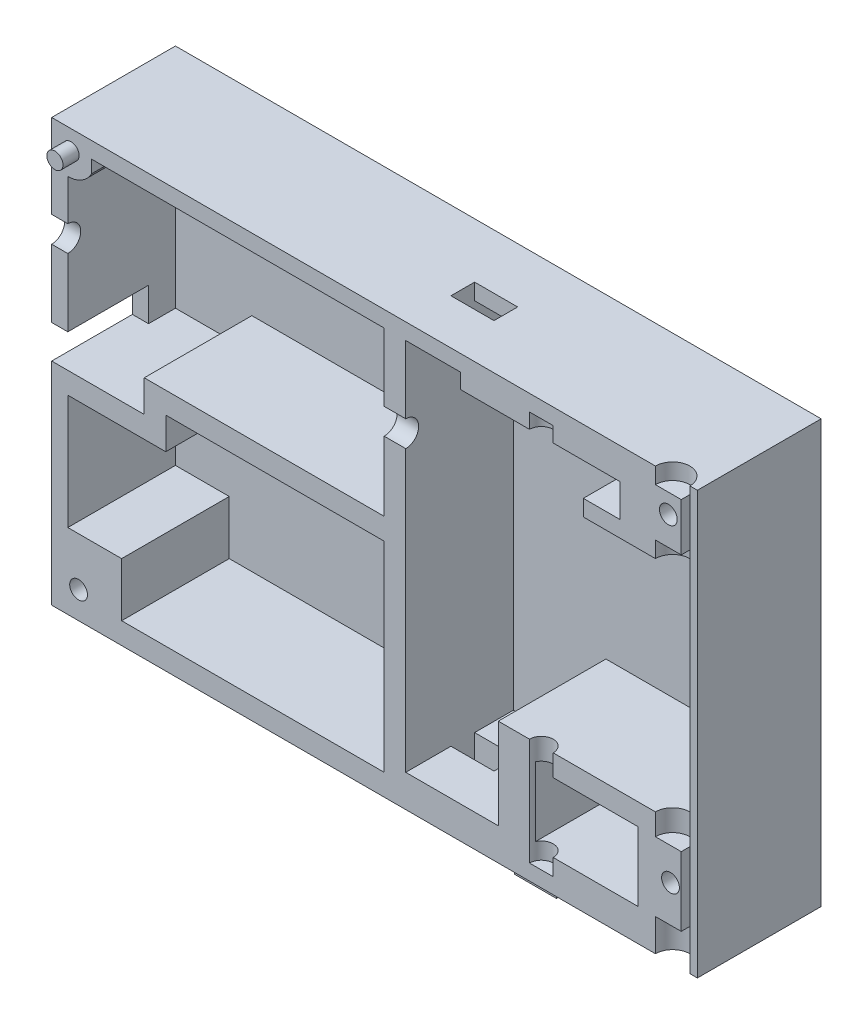
from build123d import *

# Parameters (mm, degrees)
SKETCH_1_W                      = 60
SKETCH_1_H                      = 52
EXTRUDE_1_DEPTH                 = 11.5
SHELL_1_T                       = -1.5
SKETCH_2_W                      = 15
SKETCH_2_H                      = 1.4
SKETCH_2_W_2                    = 9.1
SKETCH_2_H_2                    = 1.5
EXTRUDE_2_DEPTH                 = 10
CUT_EXTRUDE_1_REACH             = 63.125
SKETCH_3_W                      = 4
SKETCH_3_H                      = 2.2
SKETCH_4_R                      = 1.6
F_3MM_2_DEPTH                   = 62.124872188
F_2MM_4_START                   = -1.5
SKETCH_6_R                      = 1.1
F_2MM_4_DEPTH                   = 36.3
CUT_EXTRUDE_5_REACH             = 68.395
SKETCH_8_W                      = 7.5
SKETCH_8_H                      = 3.1
SKETCH_9_W                      = 5
SKETCH_9_H                      = 5
SKETCH_9_W_2                    = 5.7
SKETCH_9_H_2                    = 4.45
SKETCH_9_R                      = 0.825
SKETCH_9_W_3                    = 4
SKETCH_9_H_3                    = 6.42
EXTRUDE_4_DEPTH                 = 10
SKETCH_10_R                     = 0.75
EXTRUDE_5_DEPTH                 = 1.5
SKETCH_11_W                     = 3.9
SKETCH_11_H                     = 4
EXTRUDE_6_DEPTH                 = 4
CUT_EXTRUDE_1_2_REACH           = 43.331
SKETCH_13_R                     = 0.825
CUT_EXTRUDE_2_REACH             = 43.331
SKETCH_14_W                     = 60
SKETCH_14_H                     = 12.75
CUT_EXTRUDE_2_DIRECTION_2_REACH = 43.331
CUT_EXTRUDE_START               = -11.5
SKETCH_15_R                     = 0.825
CUT_EXTRUDE_3_DEPTH             = 5
SKETCH_16_R                     = 1.2
CUT_EXTRUDE_4_DEPTH             = 40


with BuildPart() as part:
    # 草图1 → 凸台-拉伸1 (new body)
    with BuildSketch(Plane.XY):
        Rectangle(SKETCH_1_W, SKETCH_1_H)
    extrude(amount=EXTRUDE_1_DEPTH)

    # 抽壳1
    shell_1_openings = [part.faces().sort_by_distance(p)[0] for p in [
        (0, 0, 11.5),
    ]]
    offset(amount=SHELL_1_T, openings=shell_1_openings, kind=Kind.INTERSECTION)

    # 草图2 → 凸台-拉伸2 (add)
    with BuildSketch(Plane.XY.offset(1.5)):
        Polygon((-21.4, 9.35), (0.9, 9.35), (0.9, 24.5), (2.9, 24.5), (2.9, -10.25), (11.5, -10.25), (11.5, -1.83), (28.5, -1.83), (28.5, -3.83), (14.5, -3.83), (14.5, -10.25), (28.5, -10.25), (28.5, -13.25), (-4.1, -13.25), (-28.5, -13.25), (-28.5, -11.25), (0.9, -11.25), (0.9, 7.35), (-19.4, 7.35), (-19.4, 4.4), (-28.5, 4.4), (-28.5, 6.4), (-21.4, 6.4), align=None)
        with Locations((15.5, 23.8)):
            Rectangle(SKETCH_2_W, SKETCH_2_H)
        with Locations((23.95, 19.3)):
            Rectangle(SKETCH_2_W_2, SKETCH_2_H_2)
    extrude(amount=EXTRUDE_2_DEPTH)

    # Cut-Extrude 1: up to this face of the body (flat: up to its plane)
    cut_extrude_1_end = Plane(part.part.faces().sort_by_distance((0, 26, 5.75))[0])
    # 草图3 → Cut-Extrude 1 (cut, up to the picked face)
    with BuildSketch(Plane.XZ.offset(26), mode=Mode.PRIVATE) as cut_extrude_1_sk1:
        with Locations((4.9, 6.2)):
            Rectangle(SKETCH_3_W, SKETCH_3_H)
    cut_extrude_1_tool1 = split(extrude(cut_extrude_1_sk1.sketch, amount=-CUT_EXTRUDE_1_REACH, mode=Mode.PRIVATE), bisect_by=cut_extrude_1_end, keep=Keep.BOTH, mode=Mode.PRIVATE)
    add(cut_extrude_1_tool1.solids().sort_by(Axis((4.9, -26, 6.2), (0, 1, 0)))[0], mode=Mode.SUBTRACT)

    # 草图4 → 3MM孔切除-拉伸2 (cut, through all)
    with BuildSketch(Plane.XZ.offset(26)):
        with Locations((27.7, 11.5)):
            Circle(SKETCH_4_R)
    extrude(amount=-F_3MM_2_DEPTH, mode=Mode.SUBTRACT)

    # 草图6 → 2mm孔切除-拉伸4 (cut)
    with BuildSketch(Plane(origin=(0, 26, 0), x_dir=(1, 0, 0), z_dir=(0, 1, 0)).offset(F_2MM_4_START)):
        with Locations((15.5, -11.5)):
            Circle(SKETCH_6_R)
    extrude(amount=-F_2MM_4_DEPTH, mode=Mode.SUBTRACT)

    # 草图8 → 电机线切除-拉伸5 (cut, up to next)
    with BuildSketch(Plane.ZY.offset(30), mode=Mode.PRIVATE) as cut_extrude_5_sk1:
        with Locations((7.75, 7.95)):
            Rectangle(SKETCH_8_W, SKETCH_8_H)
    cut_extrude_5_tool1 = extrude(cut_extrude_5_sk1.sketch, amount=-CUT_EXTRUDE_5_REACH, mode=Mode.PRIVATE) & part.part
    add(cut_extrude_5_tool1.solids().sort_by_distance((-30, 7.95, 7.75))[0], mode=Mode.SUBTRACT)

    # 草图9 → 螺柱支撑凸台-拉伸4 (add)
    # profile 1 of 4: a face of its own
    with BuildSketch(Plane.XY.offset(1.5)):
        with Locations((-26, -8.75)):
            Rectangle(SKETCH_9_W, SKETCH_9_H)
    # profile 2 of 4: a face of its own
    with BuildSketch(Plane.XY.offset(1.5)):
        with Locations((25.65, 22.275)):
            Rectangle(SKETCH_9_W_2, SKETCH_9_H_2)
        with Locations((27.3, 22.7)):
            Circle(SKETCH_9_R, mode=Mode.SUBTRACT)
    # profile 3 of 4: a face of its own
    with BuildSketch(Plane.XY.offset(1.5)):
        with BuildLine():
            Line((-28.5, 24.5), (-28.5, 22))
            ThreePointArc((-28.5, 22), (-27.219099052, 22.353073648), (-26.3, 23.312565791))
            Line((-26.3, 23.312565791), (-26.3, 24.5))
            Line((-26.3, 24.5), (-28.5, 24.5))
        make_face()
    # profile 4 of 4: a face of its own
    with BuildSketch(Plane.XY.offset(1.5)):
        with Locations((26.5, -7.04)):
            Rectangle(SKETCH_9_W_3, SKETCH_9_H_3)
        with Locations((27.5, -6.83)):
            Circle(SKETCH_9_R, mode=Mode.SUBTRACT)
    extrude(amount=EXTRUDE_4_DEPTH)

    # 草图10 → 上下楔凸台-拉伸5 (add)
    with BuildSketch(Plane.XY.offset(11.5)):
        with Locations((-28.2, 24.2)):
            Circle(SKETCH_10_R)
    extrude(amount=EXTRUDE_5_DEPTH)

    # 草图11 → 变速卡位凸台-拉伸6 (add)
    with BuildSketch(Plane.XY.offset(1.5)):
        with Locations((8.95, -17.4)):
            Rectangle(SKETCH_11_W, SKETCH_11_H)
    extrude(amount=EXTRUDE_6_DEPTH)

    # 草图13 → Cut-Extrude 1 2 (cut, up to next)
    with BuildSketch(Plane.XY.offset(11.5), mode=Mode.PRIVATE) as cut_extrude_1_2_sk1:
        with Locations((-27.5, -10.75)):
            Circle(SKETCH_13_R)
    cut_extrude_1_2_tool1 = extrude(cut_extrude_1_2_sk1.sketch, amount=-CUT_EXTRUDE_1_2_REACH, mode=Mode.PRIVATE) & part.part
    # 草图13 → Cut-Extrude 1 2 (cut, up to next)
    with BuildSketch(Plane.XY.offset(11.5), mode=Mode.PRIVATE) as cut_extrude_1_2_sk2:
        with Locations((27.3, 22.7)):
            Circle(SKETCH_13_R)
    cut_extrude_1_2_tool2 = extrude(cut_extrude_1_2_sk2.sketch, amount=-CUT_EXTRUDE_1_2_REACH, mode=Mode.PRIVATE) & part.part
    # 草图13 → Cut-Extrude 1 2 (cut, up to next)
    with BuildSketch(Plane.XY.offset(11.5), mode=Mode.PRIVATE) as cut_extrude_1_2_sk3:
        with Locations((27.5, -6.83)):
            Circle(SKETCH_13_R)
    cut_extrude_1_2_tool3 = extrude(cut_extrude_1_2_sk3.sketch, amount=-CUT_EXTRUDE_1_2_REACH, mode=Mode.PRIVATE) & part.part
    add(cut_extrude_1_2_tool1.solids().sort_by_distance((-27.5, -10.75, 11.5))[0], mode=Mode.SUBTRACT)
    add(cut_extrude_1_2_tool2.solids().sort_by_distance((27.3, 22.7, 11.5))[0], mode=Mode.SUBTRACT)
    add(cut_extrude_1_2_tool3.solids().sort_by_distance((27.5, -6.83, 11.5))[0], mode=Mode.SUBTRACT)

    # 草图14 → 切除-拉伸2 (cut, up to next)
    with BuildSketch(Plane.XY.offset(1.5), mode=Mode.PRIVATE) as cut_extrude_2_sk1:
        with Locations((0, -19.625)):
            Rectangle(SKETCH_14_W, SKETCH_14_H)
    cut_extrude_2_tool1 = extrude(cut_extrude_2_sk1.sketch, amount=CUT_EXTRUDE_2_REACH, mode=Mode.PRIVATE) & part.part
    add(cut_extrude_2_tool1.solids().sort_by_distance((0, -19.625, 1.5))[0], mode=Mode.SUBTRACT)

    # 草图14 → 切除-拉伸2 direction 2 (cut, up to next)
    with BuildSketch(Plane.XY.offset(1.5), mode=Mode.PRIVATE) as cut_extrude_2_direction_2_sk1:
        with Locations((0, -19.625)):
            Rectangle(SKETCH_14_W, SKETCH_14_H)
    cut_extrude_2_direction_2_tool1 = extrude(cut_extrude_2_direction_2_sk1.sketch, amount=-CUT_EXTRUDE_2_DIRECTION_2_REACH, mode=Mode.PRIVATE) & part.part
    add(cut_extrude_2_direction_2_tool1.solids().sort_by_distance((0, -19.625, 1.5))[0], mode=Mode.SUBTRACT)


with BuildPart() as cut_extrude_2_piece_1:
    # of the separate pieces the step leaves, piece 1, a body of its own (cut_extrude_2_pieces)
    add(part.part.solids().sort_by_distance((-30, 26, 0))[0])

    # 草图15 → 切除-拉伸3 (cut)
    with BuildSketch(Plane.XY.offset(11.5).offset(CUT_EXTRUDE_START)):
        with Locations((-28.2, 24.2)):
            Circle(SKETCH_15_R)
    extrude(amount=CUT_EXTRUDE_3_DEPTH, mode=Mode.SUBTRACT)

    # 草图16 → 切除-拉伸4 (cut)
    with BuildSketch(Plane.ZY.offset(30)):
        with Locations((11.5, 17)):
            Circle(SKETCH_16_R)
    extrude(amount=-CUT_EXTRUDE_4_DEPTH, mode=Mode.SUBTRACT)


with BuildPart() as cut_extrude_2_piece_2:
    # of the separate pieces the step leaves, piece 2, a body of its own (cut_extrude_2_pieces)
    add(part.part.solids().sort_by_distance((7, -15.4, 1.5))[0])


solid = Compound([cut_extrude_2_piece_1.part, cut_extrude_2_piece_2.part])
